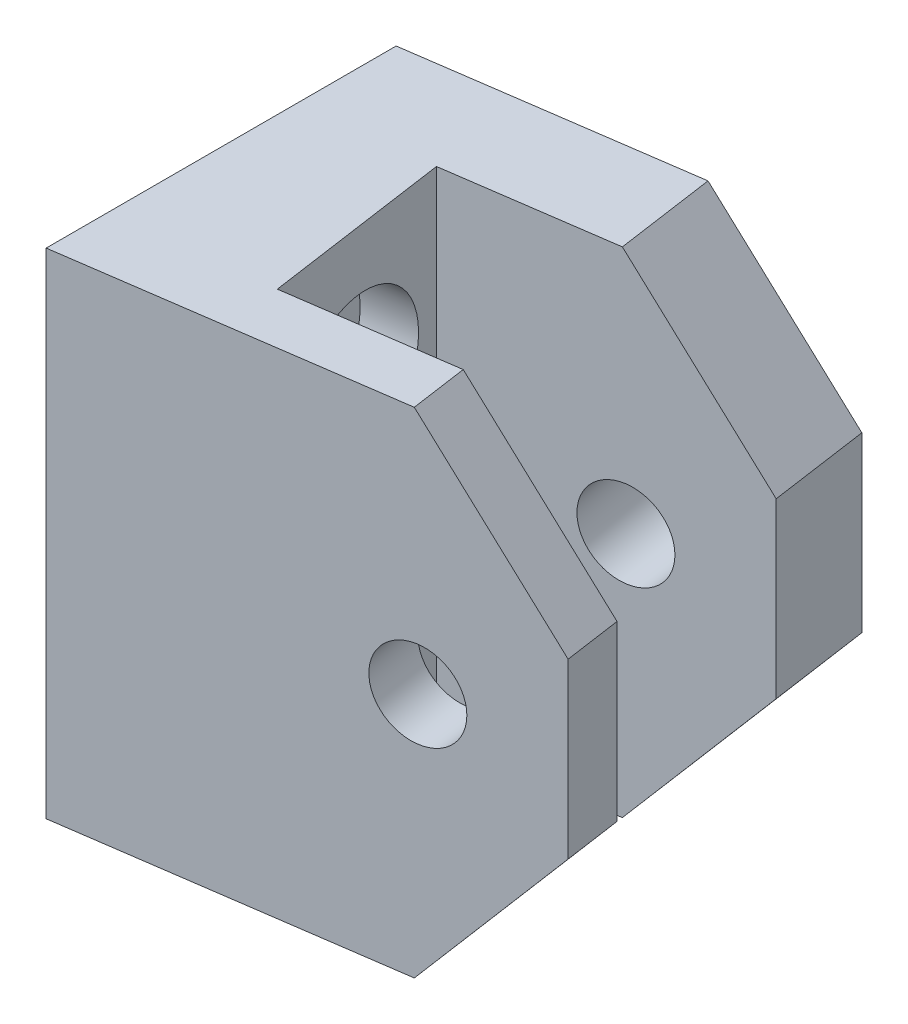
from build123d import *

# Parameters (mm, degrees)
BOSS_EXTRUDE1_DEPTH                     = 54.37886
SKETCH6_R                               = 4.762499997
CUT_EXTRUDE2_DEPTH                      = 83.40211381
CBORE_FOR_M8_HEX_HEAD_BOLT1_D           = 9
CBORE_FOR_M8_HEX_HEAD_BOLT1_CBORE_D     = 16
CBORE_FOR_M8_HEX_HEAD_BOLT1_CBORE_DEPTH = 5.68


with BuildPart() as part:
    # Sketch1 → Boss-Extrude1 (new body)
    with BuildSketch(Plane(origin=(0, 0, 0), x_dir=(1, 0, 0), z_dir=(0, 1, 0))):
        Polygon((42.900367849, 10.966428676), (-1.905000006, 4.537947795), (-1.905000006, -33.845088532), (-1.905000006, -33.965034077), (-0.021561819, -33.694806492), (48.313185258, -26.759945507), (47.411349635, -20.474311688), (14.726053775, -25.163856927), (11.793284329, -4.722975747), (44.478580189, -0.033430507), align=None)
    extrude(amount=BOSS_EXTRUDE1_DEPTH)

    # Sketch6 → Cut-Extrude2 (cut, through all)
    with BuildSketch(Plane(origin=(4.736440692, 0, 33.012148819), x_dir=(0.9898635935767917, 0, -0.1420213579404182), z_dir=(0.1420213579404182, 0, 0.9898635935767917))):
        with Locations((29.417979377, 27.18943)):
            Circle(SKETCH6_R)
        Polygon((44.022979377, 36.71443), (29.071940537, 54.37886), (44.022979377, 54.37886), align=None)
        Polygon((44.022979377, 0), (44.022979377, 17.66443), (29.071940537, 0), align=None)
    extrude(amount=-CUT_EXTRUDE2_DEPTH, mode=Mode.SUBTRACT)

    # CBORE for M8 Hex Head Bolt1 (through all)
    with Locations(Plane(origin=(10.891448706, 0, -1.562658073), x_dir=(-0.1420213579404179, 0, -0.9898635935767918), z_dir=(0.9898635935767918, 0, -0.1420213579404179))):
        with Locations((-16.6751, 39.88943), (-16.6751, 14.48943)):
            CounterBoreHole(CBORE_FOR_M8_HEX_HEAD_BOLT1_D / 2, CBORE_FOR_M8_HEX_HEAD_BOLT1_CBORE_D / 2, CBORE_FOR_M8_HEX_HEAD_BOLT1_CBORE_DEPTH)


solid = part.part
